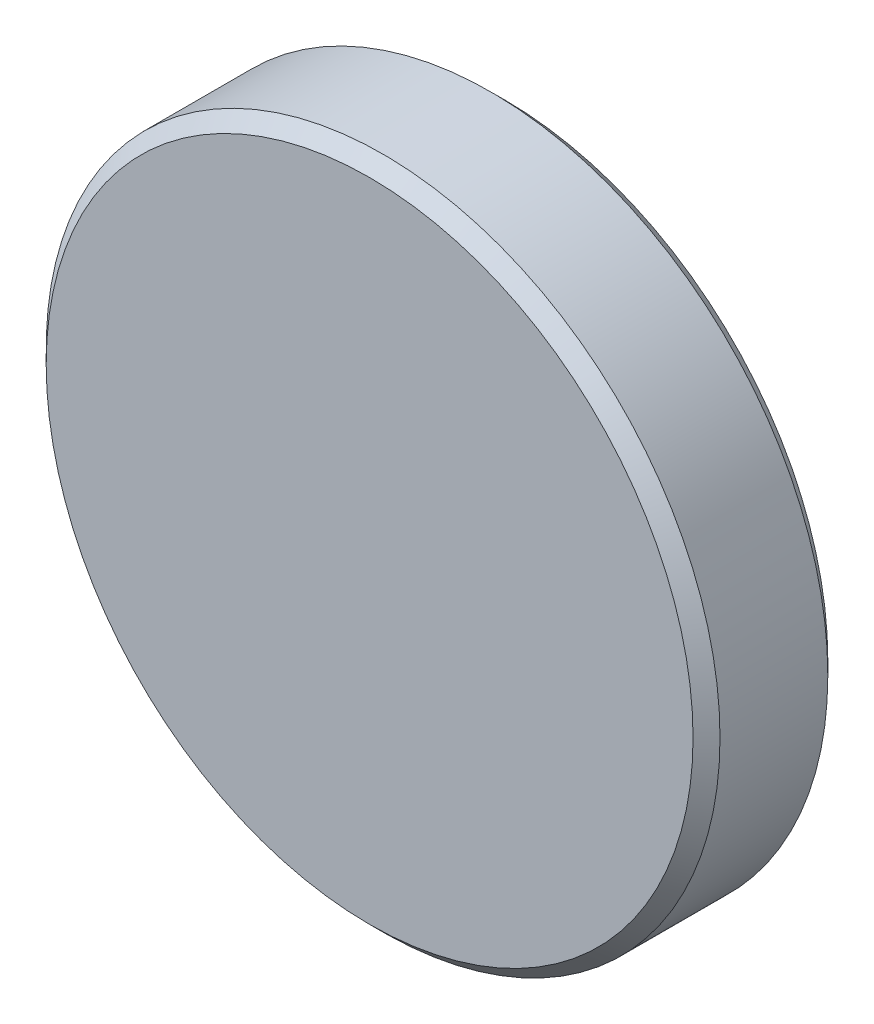
from build123d import *

# Parameters (mm, degrees)
SKETCH1_R           = 2.5
BOSS_EXTRUDE1_DEPTH = 1
CHAMFER1_SIZE       = 0.1


with BuildPart() as part:
    # Sketch1 → Boss-Extrude1 (new body)
    with BuildSketch(Plane.XY):
        Circle(SKETCH1_R)
    extrude(amount=BOSS_EXTRUDE1_DEPTH)

    # Chamfer1
    chamfer1_edges = [part.edges().sort_by_distance(p)[0] for p in [
        (-2.5, 0, 0),
        (-2.5, 0, 1),
    ]]
    chamfer(chamfer1_edges, length=CHAMFER1_SIZE)


solid = part.part
